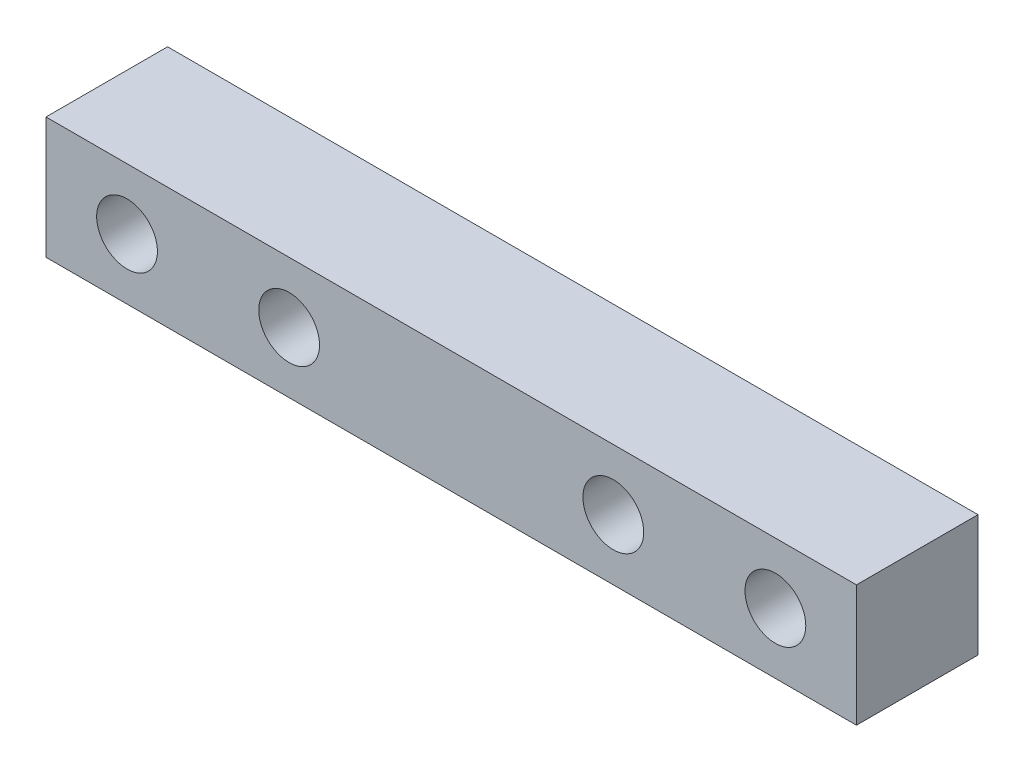
from build123d import *

# Parameters (mm, degrees)
SKETCH_1_W          = 40
SKETCH_1_H          = 6
SKETCH_1_R          = 1.25
EXTRUDE_1_DEPTH     = 6
SKETCH_3_R          = 1.5
CUT_EXTRUDE_1_DEPTH = 22.09502311


with BuildPart() as part:
    # 草图1 → 凸台-拉伸1 (new body)
    with BuildSketch(Plane.XY):
        Rectangle(SKETCH_1_W, SKETCH_1_H)
        with Locations((-16, 0)):
            Circle(SKETCH_1_R, mode=Mode.SUBTRACT)
        with Locations((16, 0)):
            Circle(SKETCH_1_R, mode=Mode.SUBTRACT)
        with Locations((-8, 0)):
            Circle(SKETCH_1_R, mode=Mode.SUBTRACT)
        with Locations((8, 0)):
            Circle(SKETCH_1_R, mode=Mode.SUBTRACT)
    extrude(amount=EXTRUDE_1_DEPTH)

    # 草图3 → 切除-拉伸1 (cut, through all)
    with BuildSketch(Plane.XY.offset(6)):
        with Locations((-16, 0)):
            Circle(SKETCH_3_R)
        with Locations((-8, 0)):
            Circle(SKETCH_3_R)
        with Locations((8, 0)):
            Circle(SKETCH_3_R)
        with Locations((16, 0)):
            Circle(SKETCH_3_R)
    extrude(amount=-CUT_EXTRUDE_1_DEPTH, mode=Mode.SUBTRACT)


solid = part.part
